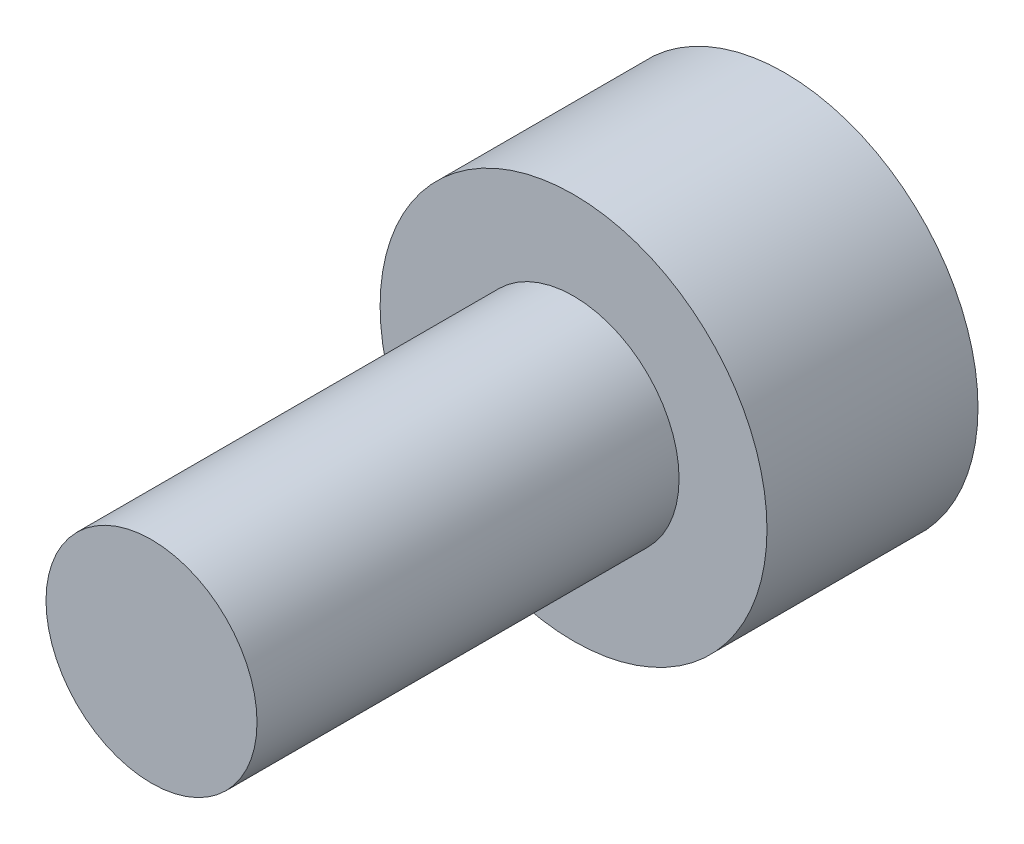
from build123d import *

# Parameters (mm, degrees)
SKETCH1_R          = 1.5
EXTRUDE1_DEPTH     = 6
SKETCH6_R          = 2.75
EXTRUDE2_DEPTH     = 3
CUT_EXTRUDE1_DEPTH = 1.875


with BuildPart() as part:
    # Sketch1 → Extrude1 (new body)
    with BuildSketch(Plane.XY):
        Circle(SKETCH1_R)
    extrude(amount=-EXTRUDE1_DEPTH)

    # Sketch6 → Extrude2 (add)
    with BuildSketch(Plane(origin=(0, 0, -6), x_dir=(-1, 0, 0), z_dir=(0, 0, -1))):
        Circle(SKETCH6_R)
    extrude(amount=EXTRUDE2_DEPTH)

    # Sketch7 → Cut-Extrude1 (cut)
    with BuildSketch(Plane(origin=(0, 0, -9), x_dir=(-1, 0, 0), z_dir=(0, 0, -1))):
        Polygon((0, 1.443375673), (-1.25, 0.721687836), (-1.25, -0.721687836), (0, -1.443375673), (1.25, -0.721687836), (1.25, 0.721687836), align=None)
    extrude(amount=-CUT_EXTRUDE1_DEPTH, mode=Mode.SUBTRACT)


solid = part.part
